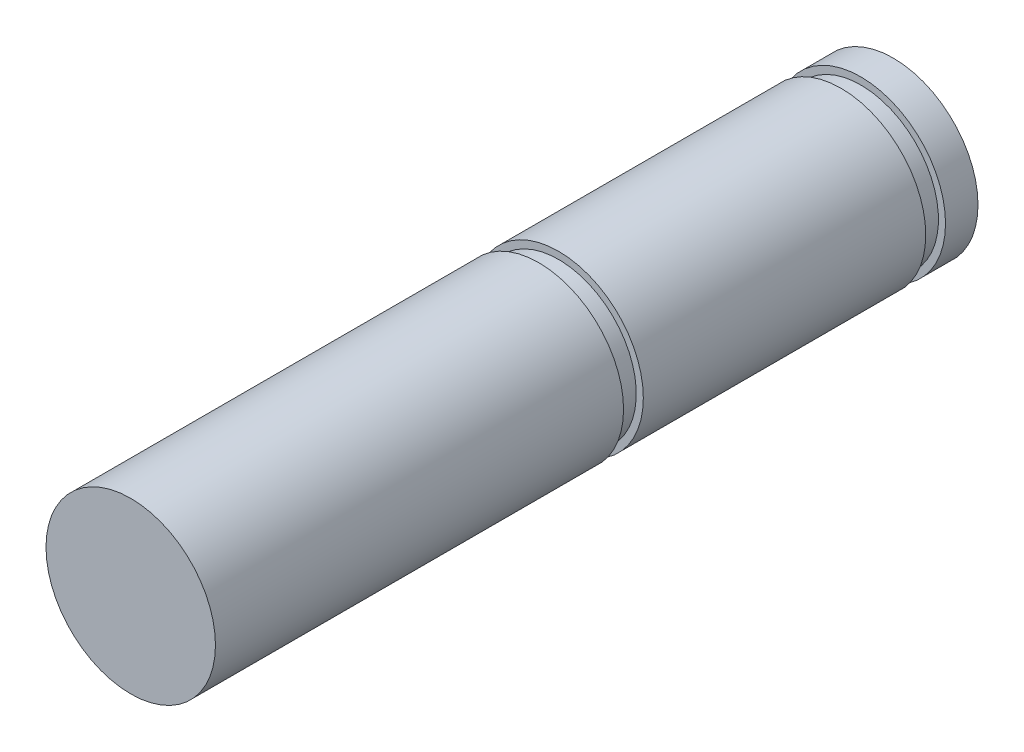
from build123d import *

# Parameters (mm, degrees)
SKETCH_1_R               = 3
EXTRUDE_1_DEPTH          = 27
CUT_EXTRUDE_1_DEPTH      = 0.35
CUT_EXTRUDE_1_DEPTH_BACK = 0.35
SKETCH_2_R               = 3
SKETCH_2_R_2             = 2.75
SKETCH_3_R               = 3
SKETCH_3_R_2             = 2.75
CUT_EXTRUDE_2_DEPTH      = 0.7


with BuildPart() as part:
    # 스케치1 → 보스-돌출1 (new body)
    with BuildSketch(Plane.XY):
        Circle(SKETCH_1_R)
    extrude(amount=EXTRUDE_1_DEPTH)

    # 스케치2 → 컷-돌출1 (cut, two sides: drawn at the far end of the back side and taken through both)
    with BuildSketch(Plane(origin=(0, 0, 1.5), x_dir=(-1, 0, 0), z_dir=(0, 0, -1)).offset(-CUT_EXTRUDE_1_DEPTH_BACK)):
        Circle(SKETCH_2_R)
        Circle(SKETCH_2_R_2, mode=Mode.SUBTRACT)
    extrude(amount=CUT_EXTRUDE_1_DEPTH + CUT_EXTRUDE_1_DEPTH_BACK, mode=Mode.SUBTRACT)

    # 스케치3 → 컷-돌출2 (cut)
    with BuildSketch(Plane(origin=(0, 0, 11.85), x_dir=(-1, 0, 0), z_dir=(0, 0, -1))):
        Circle(SKETCH_3_R)
        Circle(SKETCH_3_R_2, mode=Mode.SUBTRACT)
    extrude(amount=-CUT_EXTRUDE_2_DEPTH, mode=Mode.SUBTRACT)


solid = part.part
